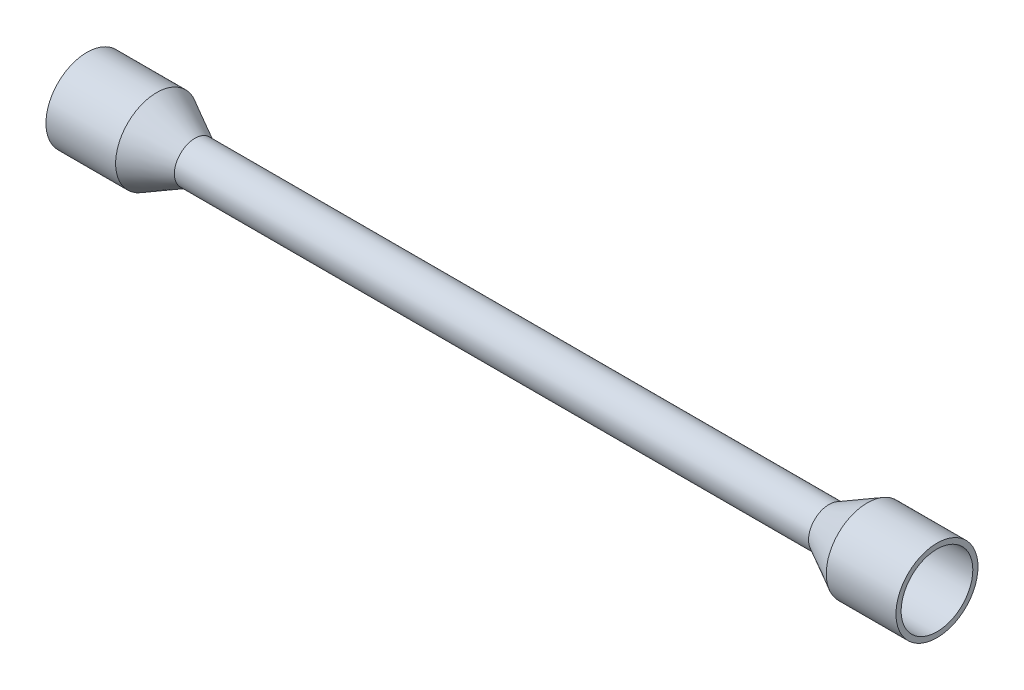
from build123d import *


with BuildPart() as part:
    # Sketch1 → Revolve1 (revolve)
    with BuildSketch(Plane(origin=(0, 0, 0), x_dir=(1, 0, 0), z_dir=(0, 1, 0))):
        Polygon((-250, 24.125), (-209, 24.125), (-186.495513174, 12.0625), (0, 12.0625), (186.495513174, 12.0625), (209, 24.125), (250, 24.125), (250, 21.075), (209.765866437, 21.075), (187.261379611, 9.0125), (187.261379611, 0), (-187.261379611, 0), (-187.261379611, 9.0125), (-209.765866437, 21.075), (-250, 21.075), align=None)
    revolve(axis=Axis((250, 0, 0), (-1, 0, 0)))


solid = part.part
